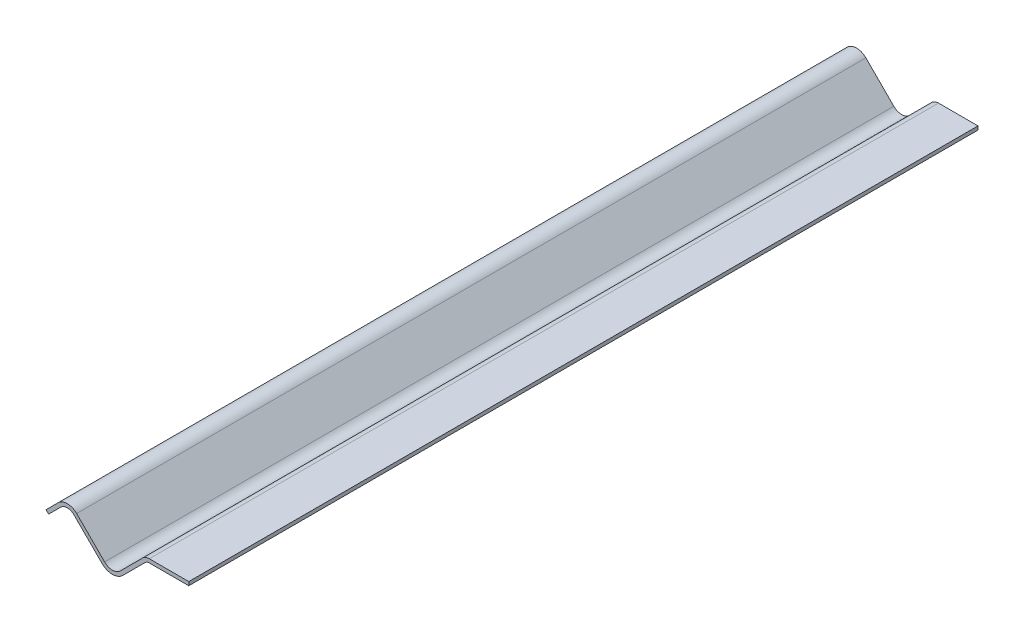
from build123d import *

# Parameters (mm, degrees)
BOSS_EXTRUDE1_DEPTH = 76.073


with BuildPart() as part:
    # Sketch2 → Boss-Extrude1 (new, symmetric)
    with BuildSketch(Plane.XY):
        with BuildLine():
            Line((0, 0), (2.319363294, 2.319363294))
            ThreePointArc((2.319363294, 2.319363294), (4.112834168, 3.062243254), (5.906305043, 2.319363294))
            Line((5.906305043, 2.319363294), (11.294458716, -3.068790379))
            ThreePointArc((11.294458716, -3.068790379), (12.801967136, -3.693220812), (14.309475557, -3.068790379))
            Line((14.309475557, -3.068790379), (18.611821536, 1.2335556))
            ThreePointArc((18.611821536, 1.2335556), (19.20388726, 1.629161269), (19.902276401, 1.768079507))
            Line((19.902276401, 1.768079507), (27.522276401, 1.768079507))
            Line((27.522276401, 1.768079507), (27.522276401, 1.063874985))
            Line((27.522276401, 1.063874985), (19.902276401, 1.063874985))
            ThreePointArc((19.902276401, 1.063874985), (19.473374664, 0.978561125), (19.109769329, 0.735607807))
            Line((19.109769329, 0.735607807), (14.80742335, -3.566738172))
            ThreePointArc((14.80742335, -3.566738172), (12.801967136, -4.397425334), (10.796510923, -3.566738172))
            Line((10.796510923, -3.566738172), (5.40835725, 1.821415501))
            ThreePointArc((5.40835725, 1.821415501), (4.112834168, 2.358038732), (2.817311086, 1.821415501))
            Line((2.817311086, 1.821415501), (0.497947793, -0.497947793))
            Line((0.497947793, -0.497947793), (0, 0))
        make_face()
    extrude(amount=BOSS_EXTRUDE1_DEPTH, both=True)


solid = part.part
